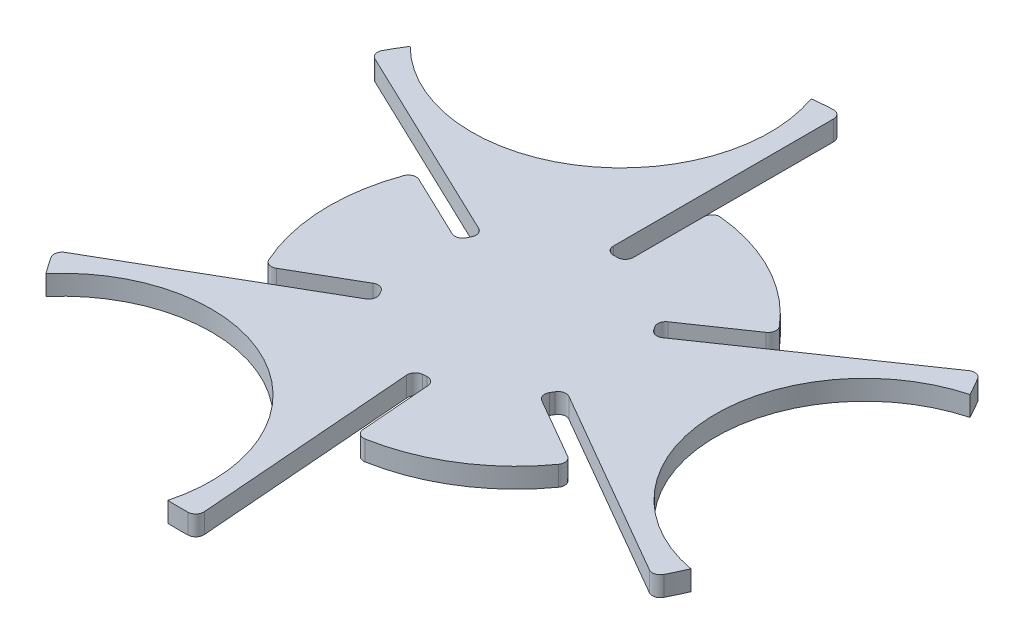
from build123d import *

# Parameters (mm, degrees)
EXTRUDE_1_DEPTH = 5
EXTRUDE_2_DEPTH = 5
FILLET_1_R      = 2


with BuildPart() as part:
    # 草圖1 → 填料-伸長1 (new body)
    with BuildSketch(Plane(origin=(0, 0, 0), x_dir=(1, 0, 0), z_dir=(0, 1, 0))):
        with BuildLine():
            Line((41.895571715, -21.301668261), (22.900635095, -10.334936491))
            Line((22.900635095, -10.334936491), (20.400635095, -14.665063509))
            Line((20.400635095, -14.665063509), (39.395571715, -25.63179528))
            ThreePointArc((39.395571715, -25.63179528), (25.066666667, -39.75754296), (6.143670641, -46.596730691))
            Line((6.143670641, -46.596730691), (4.437329437, -24.729741355))
            Line((4.437329437, -24.729741355), (-0.547516958, -25.118722602))
            Line((-0.547516958, -25.118722602), (1.158824246, -46.985711938))
            ThreePointArc((1.158824246, -46.985711938), (-21.897708862, -41.587141602), (-39.395571715, -25.63179528))
            Line((-39.395571715, -25.63179528), (-20.400635095, -14.665063509))
            Line((-20.400635095, -14.665063509), (-22.900635095, -10.334936491))
            Line((-22.900635095, -10.334936491), (-41.895571715, -21.301668261))
            ThreePointArc((-41.895571715, -21.301668261), (-46.964375529, -1.829598641), (-43.425787832, 17.977790497))
            Line((-43.425787832, 17.977790497), (-23.635248961, 8.522030659))
            Line((-23.635248961, 8.522030659), (-21.479693405, 13.033524896))
            Line((-21.479693405, 13.033524896), (-41.270232276, 22.489284734))
            ThreePointArc((-41.270232276, 22.489284734), (-25.066666667, 39.75754296), (-2.5, 46.933463541))
            Line((-2.5, 46.933463541), (-2.5, 25))
            Line((-2.5, 25), (2.5, 25))
            Line((2.5, 25), (2.5, 46.933463541))
            ThreePointArc((2.5, 46.933463541), (21.897708862, 41.587141602), (37.282117191, 28.618940193))
            Line((37.282117191, 28.618940193), (19.197919523, 16.207710695))
            Line((19.197919523, 16.207710695), (22.027210363, 12.085197706))
            Line((22.027210363, 12.085197706), (40.111408031, 24.496427205))
            ThreePointArc((40.111408031, 24.496427205), (46.964375529, 1.829598641), (41.895571715, -21.301668261))
        make_face()
    extrude(amount=-EXTRUDE_1_DEPTH)

    # 草圖2 → 填料-伸長2 (add)
    with BuildSketch(Plane(origin=(0, 0, 0), x_dir=(1, 0, 0), z_dir=(0, 1, 0))):
        with BuildLine():
            ThreePointArc((-21.897708534, -41.587141774), (-31.667962065, -34.729528915), (-39.395571715, -25.63179528))
            Line((-39.395571715, -25.63179528), (-71.897112041, -44.396568337))
            ThreePointArc((-71.897112041, -44.396568337), (-69.935607979, -47.426371742), (-67.846508155, -50.369646923))
            ThreePointArc((-67.846508155, -50.369646923), (-46.409467113, -37.935155113), (-21.897708534, -41.587141774))
        make_face()
        with BuildLine():
            ThreePointArc((1.158824246, -46.985711938), (-10.715011448, -45.76230468), (-21.897708534, -41.587141774))
            ThreePointArc((-21.897708534, -41.587141774), (-5.016457748, -59.73064391), (-3.138403923, -84.441698353))
            ThreePointArc((-3.138403923, -84.441698353), (0.470468308, -84.498690283), (4.078482182, -84.401516474))
            Line((4.078482182, -84.401516474), (1.158824246, -46.985711938))
        make_face()
        with BuildLine():
            ThreePointArc((46.964375577, 1.829597397), (45.910635161, -10.060495966), (41.895571715, -21.301668261))
            Line((41.895571715, -21.301668261), (74.397112041, -40.066441318))
            ThreePointArc((74.397112041, -40.066441318), (76.040246727, -36.852827268), (77.544647892, -33.571976159))
            ThreePointArc((77.544647892, -33.571976159), (56.057542109, -21.224200551), (46.964375577, 1.829597397))
        make_face()
        with BuildLine():
            ThreePointArc((40.111408031, 24.496427205), (44.988824347, 13.601679451), (46.964375577, 1.829597397))
            ThreePointArc((46.964375577, 1.829597397), (54.236483405, 25.520941458), (74.697857874, 39.502911652))
            ThreePointArc((74.697857874, 39.502911652), (72.942778218, 42.656782648), (71.054616293, 45.732827415))
            Line((71.054616293, 45.732827415), (40.111408031, 24.496427205))
        make_face()
        with BuildLine():
            ThreePointArc((-25.066667605, 39.757542368), (-14.242673622, 44.79002398), (-2.5, 46.933463541))
            Line((-2.5, 46.933463541), (-2.5, 84.463009655))
            ThreePointArc((-2.5, 84.463009655), (-6.104638749, 84.27919901), (-9.698139737, 83.941623082))
            ThreePointArc((-9.698139737, 83.941623082), (-9.648074589, 59.159354704), (-25.066667605, 39.757542368))
        make_face()
        with BuildLine():
            ThreePointArc((-41.270232276, 22.489284734), (-34.273812918, 32.160624187), (-25.066667605, 39.757542368))
            ThreePointArc((-25.066667605, 39.757542368), (-49.220026504, 34.209701843), (-71.559453951, 44.938786701))
            ThreePointArc((-71.559453951, 44.938786701), (-73.413246526, 41.841907635), (-75.133098475, 38.668689059))
            Line((-75.133098475, 38.668689059), (-41.270232276, 22.489284734))
        make_face()
    extrude(amount=-EXTRUDE_2_DEPTH)

    # 圓角1
    fillet_1_edges = [part.edges().sort_by_distance(p)[0] for p in [
        (71.054616293, -2.5, -45.732827415),
        (-2.5, -2.5, -84.463009655),
        (-75.133098475, -2.5, -38.668689059),
        (4.437329437, -2.5, 24.729741355),
        (-0.547516958, -2.5, 25.118722602),
        (-20.400635095, -2.5, 14.665063509),
        (-22.900635095, -2.5, 10.334936491),
        (-41.895571715, -2.5, 21.301668261),
        (-43.425787832, -2.5, -17.977790497),
        (-23.635248961, -2.5, -8.522030659),
        (-21.479693405, -2.5, -13.033524896),
        (-2.5, -2.5, -25),
        (2.5, -2.5, -25),
        (2.5, -2.5, -46.933463541),
        (37.282117191, -2.5, -28.618940193),
        (19.197919523, -2.5, -16.207710695),
        (22.027210363, -2.5, -12.085197706),
        (22.900635095, -2.5, 10.334936491),
        (20.400635095, -2.5, 14.665063509),
        (39.395571715, -2.5, 25.63179528),
        (6.143670641, -2.5, 46.596730691),
        (-71.897112041, -2.5, 44.396568337),
        (4.078482182, -2.5, 84.401516474),
        (74.397112041, -2.5, 40.066441318),
    ]]
    fillet(fillet_1_edges, radius=FILLET_1_R)


solid = part.part
